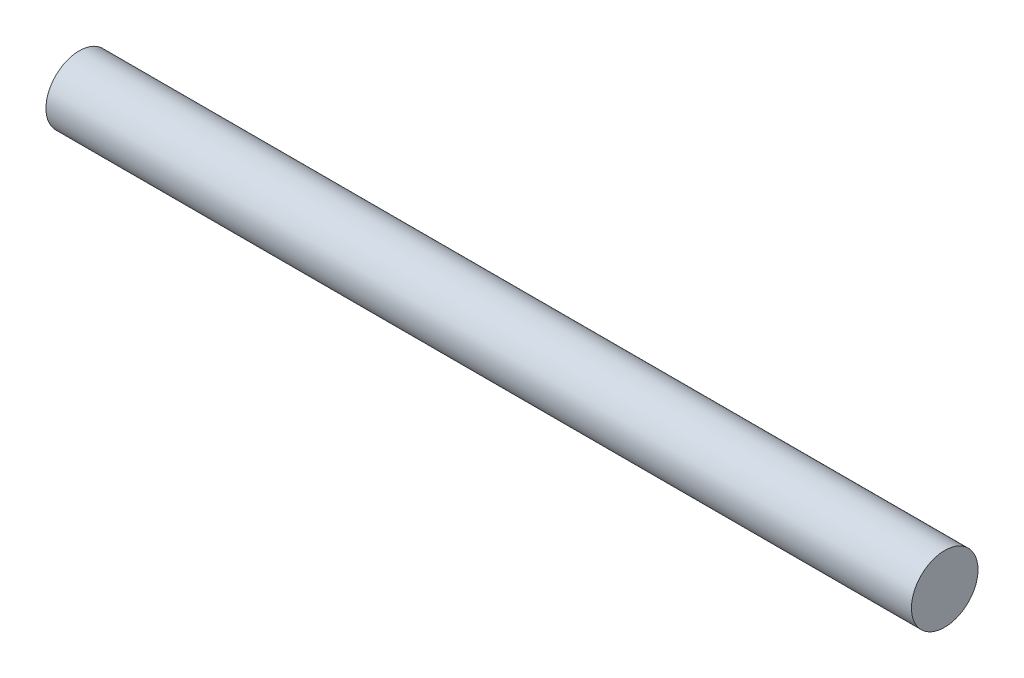
from build123d import *

# Parameters (mm, degrees)
SKETCH1_R           = 0.5
BOSS_EXTRUDE1_DEPTH = 13


with BuildPart() as part:
    # Sketch1 → Boss-Extrude1 (new body)
    with BuildSketch(Plane(origin=(0, 0, 0), x_dir=(0, 0, -1), z_dir=(1, 0, 0))):
        Circle(SKETCH1_R)
    extrude(amount=BOSS_EXTRUDE1_DEPTH)


solid = part.part
